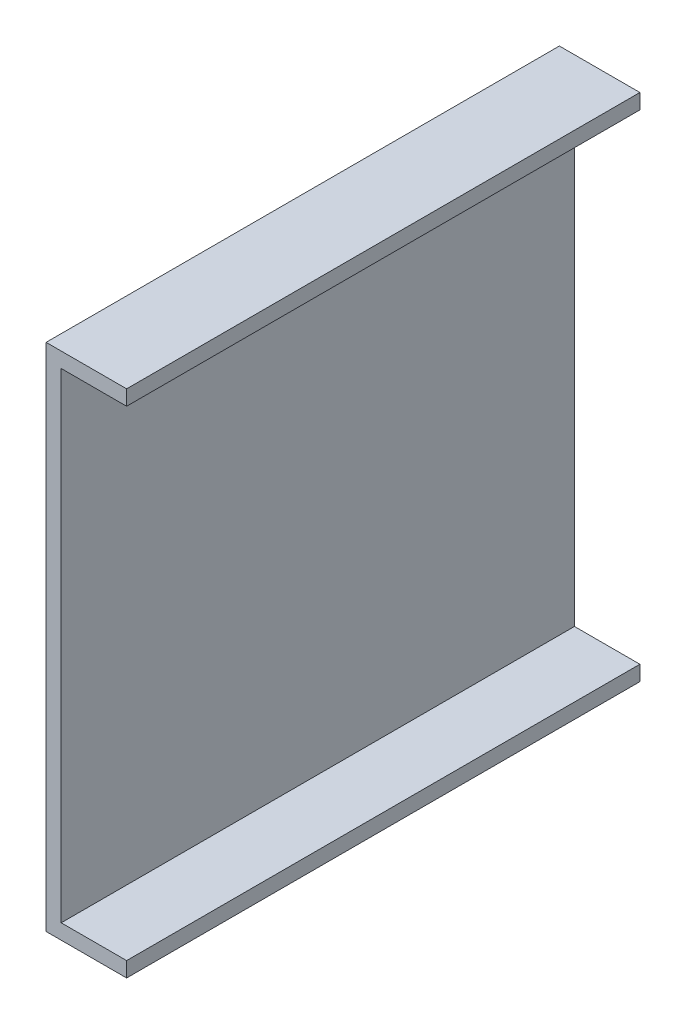
from build123d import *

# Parameters (mm, degrees)
BOSS_EXTRUDE1_DEPTH = 510


with BuildPart() as part:
    # Sketch1 → Boss-Extrude1 (new body)
    with BuildSketch(Plane.XY):
        Polygon((0, 0), (80, 0), (80, -15), (15, -15), (15, -492), (80, -492), (80, -507), (0, -507), align=None)
    extrude(amount=BOSS_EXTRUDE1_DEPTH)


solid = part.part
